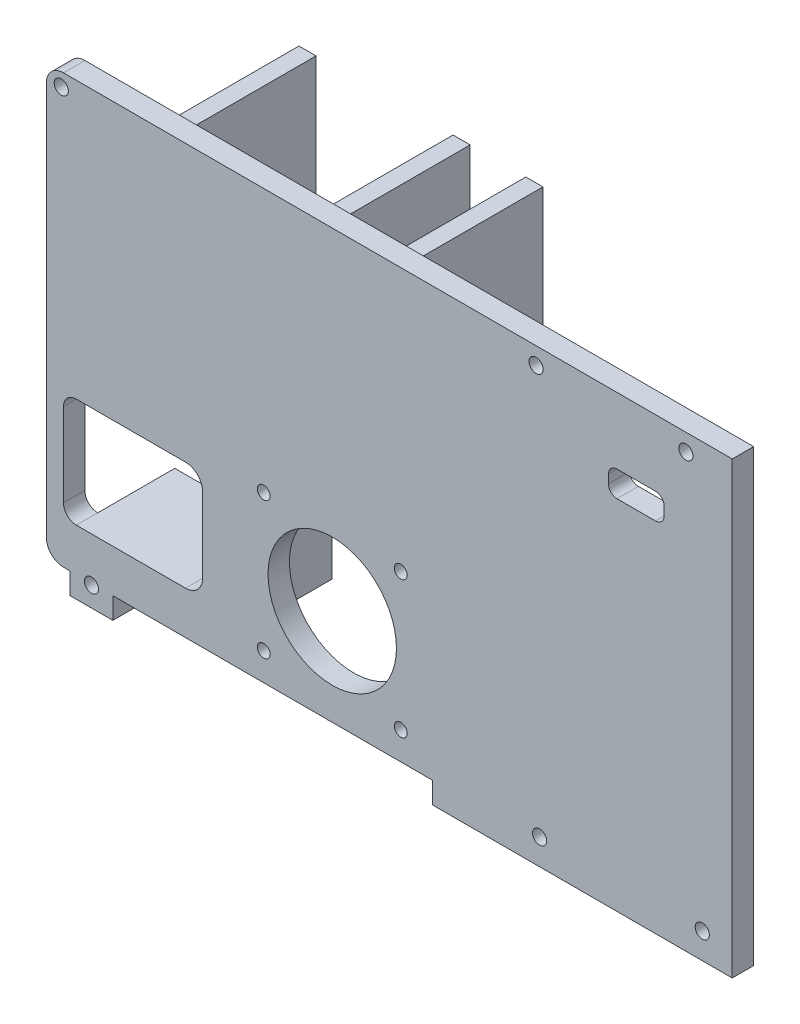
from build123d import *

# Parameters (mm, degrees)
EXTRUDE_1_DEPTH          = 5
SKETCH_2_W               = 4
SKETCH_2_H               = 40
EXTRUDE_2_DEPTH          = 36
EXTRUDE_3_DEPTH          = 7.5
CUT_EXTRUDE_2_DEPTH      = 14
EXTRUDE_START            = 18
SKETCH_5_W               = 5
SKETCH_5_H               = 27.5
EXTRUDE_4_DEPTH          = 18
SKETCH_6_R               = 15
SKETCH_6_R_2             = 1.5
CUT_EXTRUDE_3_DEPTH      = 18
CUT_EXTRUDE_4_DEPTH      = 15
CUT_EXTRUDE_4_DEPTH_BACK = 26
SKETCH_9_R               = 1.65
CUT_EXTRUDE_5_DEPTH      = 41
RIB_2_REACH              = 138.99
SKETCH_10_WALL_W         = 293.529278964
SKETCH_10_WALL_H         = 10
EXTRUDE_6_DEPTH          = 5
SKETCH_12_W              = 36
SKETCH_12_H              = 5
CUT_EXTRUDE_6_DEPTH      = 87


with BuildPart() as part:
    # 草图1 → 凸台-拉伸1 (new body)
    with BuildSketch(Plane.XY):
        with BuildLine():
            Line((105.214975384, -55), (105.214975384, 50))
            Line((105.214975384, 50), (-51, 50))
            ThreePointArc((-51, 50), (-53.828427125, 48.828427125), (-55, 46))
            Line((-55, 46), (-55, -46))
            ThreePointArc((-55, -46), (-53.828427125, -48.828427125), (-51, -50))
            Line((-51, -50), (-49.468062182, -50))
            Line((-49.468062182, -50), (-49.468062182, -55))
            Line((-49.468062182, -55), (-39.468062182, -55))
            Line((-39.468062182, -55), (-39.468062182, -50))
            Line((-39.468062182, -50), (35.214975384, -50))
            Line((35.214975384, -50), (35.214975384, -55))
            Line((35.214975384, -55), (105.214975384, -55))
        make_face()
    extrude(amount=EXTRUDE_1_DEPTH)

    # 草图2 → 凸台-拉伸2 (add)
    with BuildSketch(Plane(origin=(0, 0, 0), x_dir=(-1, 0, 0), z_dir=(0, 0, -1))):
        with Locations((35, 21.933022766)):
            Rectangle(SKETCH_2_W, SKETCH_2_H)
        with Locations((-1, 21.933022766)):
            Rectangle(SKETCH_2_W, SKETCH_2_H)
        with Locations((-18, 21.933022766)):
            Rectangle(SKETCH_2_W, SKETCH_2_H)
    extrude(amount=EXTRUDE_2_DEPTH)

    # 草图3 → 凸台-拉伸3 (add, symmetric)
    with BuildSketch(Plane(origin=(0, 20, 0), x_dir=(1, 0, 0), z_dir=(0, 1, 0))):
        Polygon((20, 12.468062182), (20, 0), (30.673808223, 0), align=None)
        Polygon((16, 12.468062182), (9.436406156, 0), (16, 0), align=None)
        Polygon((3, 12.468062182), (3, 0), (9.436406156, 0), align=None)
        Polygon((-1, 12.468062182), (-8.755927232, 0), (-1, 0), align=None)
        Polygon((-33, 12.468062182), (-33, 0), (-24.531937818, 0), align=None)
        Polygon((-37, 12.468062182), (-49.468062182, 0), (-37, 0), align=None)
    extrude(amount=EXTRUDE_3_DEPTH, both=True)

    # 草图4 → 切除-拉伸2 (cut)
    with BuildSketch(Plane(origin=(0, 0, 0), x_dir=(-1, 0, 0), z_dir=(0, 0, -1))):
        with BuildLine():
            Line((18.5, -18.5), (18.5, -36))
            ThreePointArc((18.5, -36), (19.671572875, -38.828427125), (22.5, -40))
            Line((22.5, -40), (48, -40))
            ThreePointArc((48, -40), (50.121320344, -39.121320344), (51, -37))
            Line((51, -37), (51, -17.5))
            ThreePointArc((51, -17.5), (50.121320344, -15.378679656), (48, -14.5))
            Line((48, -14.5), (22.5, -14.5))
            ThreePointArc((22.5, -14.5), (19.671572875, -15.671572875), (18.5, -18.5))
        make_face()
    extrude(amount=-CUT_EXTRUDE_2_DEPTH, mode=Mode.SUBTRACT)

    # 草图5 → 凸台-拉伸4 (add)
    with BuildSketch(Plane(origin=(0, 0, 0), x_dir=(-1, 0, 0), z_dir=(0, 0, -1)).offset(EXTRUDE_START)):
        with Locations((-43.5, -27.25)):
            Rectangle(SKETCH_5_W, SKETCH_5_H)
        with BuildLine():
            Line((18.5, -18.5), (18.5, -36))
            ThreePointArc((18.5, -36), (19.671572875, -38.828427125), (22.5, -40))
            Line((22.5, -40), (48, -40))
            Line((48, -40), (48, -44))
            Line((48, -44), (11.223006292, -44))
            Line((11.223006292, -44), (11.223006292, -41))
            Line((11.223006292, -41), (11.223006292, -13.5))
            Line((11.223006292, -13.5), (11.223006292, -10.5))
            Line((11.223006292, -10.5), (48, -10.5))
            Line((48, -10.5), (48, -14.5))
            Line((48, -14.5), (22.5, -14.5))
            ThreePointArc((22.5, -14.5), (19.671572875, -15.671572875), (18.5, -18.5))
        make_face()
    extrude(amount=-EXTRUDE_4_DEPTH)

    # 草图6 → 切除-拉伸3 (cut)
    with BuildSketch(Plane(origin=(0, 0, 0), x_dir=(-1, 0, 0), z_dir=(0, 0, -1))):
        with Locations((-11.776993708, -27.5)):
            Circle(SKETCH_6_R)
        with Locations((4.223006292, -43.5)):
            Circle(SKETCH_6_R_2)
        with Locations((4.223006292, -11.5)):
            Circle(SKETCH_6_R_2)
        with Locations((-27.776993708, -11.5)):
            Circle(SKETCH_6_R_2)
        with Locations((-27.776993708, -43.5)):
            Circle(SKETCH_6_R_2)
    extrude(amount=-CUT_EXTRUDE_3_DEPTH, mode=Mode.SUBTRACT)

    # 草图7 → 切除-拉伸4 (cut, two sides: drawn at the far end of the back side and taken through both)
    with BuildSketch(Plane.XY.offset(5).offset(-CUT_EXTRUDE_4_DEPTH_BACK)):
        with BuildLine():
            Line((78.295417345, 28.5), (87.295417345, 28.5))
            ThreePointArc((87.295417345, 28.5), (88.709630907, 29.085786438), (89.295417345, 30.5))
            Line((89.295417345, 30.5), (89.295417345, 32.5))
            ThreePointArc((89.295417345, 32.5), (88.709630907, 33.914213562), (87.295417345, 34.5))
            Line((87.295417345, 34.5), (78.295417345, 34.5))
            ThreePointArc((78.295417345, 34.5), (76.881203783, 33.914213562), (76.295417345, 32.5))
            Line((76.295417345, 32.5), (76.295417345, 30.5))
            ThreePointArc((76.295417345, 30.5), (76.881203783, 29.085786438), (78.295417345, 28.5))
        make_face()
    extrude(amount=CUT_EXTRUDE_4_DEPTH + CUT_EXTRUDE_4_DEPTH_BACK, mode=Mode.SUBTRACT)

    # 草图9 → 切除-拉伸5 (cut)
    with BuildSketch(Plane.XY.offset(5)):
        with Locations((-44.468062182, -50.360148647)):
            Circle(SKETCH_9_R)
        with Locations((-51.519821375, 46.879485601)):
            Circle(SKETCH_9_R)
        with Locations((60.214975384, -48.977955399)):
            Circle(SKETCH_9_R)
        with Locations((59.391625653, 46)):
            Circle(SKETCH_9_R)
        with Locations((98.214975384, -48.977955399)):
            Circle(SKETCH_9_R)
        with Locations((94.391625653, 46)):
            Circle(SKETCH_9_R)
    extrude(amount=-CUT_EXTRUDE_5_DEPTH, mode=Mode.SUBTRACT)

    # 草图10 wall → 筋2 (add, up to next)
    with BuildSketch(Plane(origin=(50.748705284, -30, -7.378924001), x_dir=(0.541169685132, 0, 0.840913415218), z_dir=(0.840913415218, 0, -0.541169685132)), mode=Mode.PRIVATE) as rib_2_sk1:
        Rectangle(SKETCH_10_WALL_W, SKETCH_10_WALL_H)
    rib_2_tool1 = extrude(rib_2_sk1.sketch, amount=-RIB_2_REACH, mode=Mode.PRIVATE) - part.part
    add(rib_2_tool1.solids().sort_by_distance((50.748705284, -30, -7.378924001))[0])

    # 草图11 → 凸台-拉伸6 (add)
    with BuildSketch(Plane(origin=(46, 0, 0), x_dir=(0, 0, -1), z_dir=(1, 0, 0))):
        Polygon((18, -13.5), (0, -4.773458624), (0, -13.5), align=None)
    extrude(amount=-EXTRUDE_6_DEPTH)

    # 草图12 → 切除-拉伸6 (cut)
    with BuildSketch(Plane(origin=(20, 0, 0), x_dir=(0, 0, -1), z_dir=(1, 0, 0))):
        with Locations((18, 4.433022766)):
            Rectangle(SKETCH_12_W, SKETCH_12_H)
    extrude(amount=-CUT_EXTRUDE_6_DEPTH, mode=Mode.SUBTRACT)


solid = part.part
